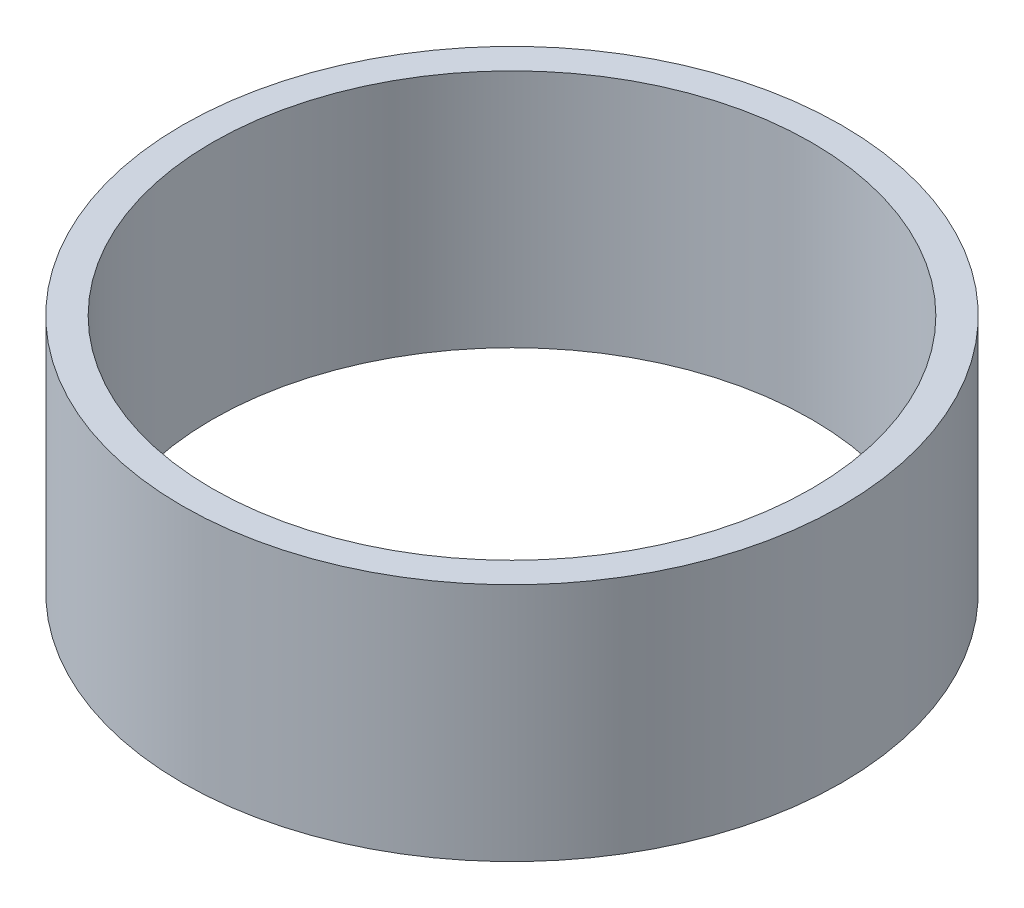
from build123d import *

# Parameters (mm, degrees)
SKETCH1_R           = 11
BOSS_EXTRUDE1_DEPTH = 8
SKETCH2_R           = 10
CUT_EXTRUDE1_DEPTH  = 18.492855685


with BuildPart() as part:
    # Sketch1 → Boss-Extrude1 (new body)
    with BuildSketch(Plane(origin=(0, 0, 0), x_dir=(1, 0, 0), z_dir=(0, 1, 0))):
        with Locations(Location((0, 0, 0), (0, 0, 270))):
            Circle(SKETCH1_R)
    extrude(amount=BOSS_EXTRUDE1_DEPTH)

    # Sketch2 → Cut-Extrude1 (cut, through all)
    with BuildSketch(Plane(origin=(0, 8, 0), x_dir=(1, 0, 0), z_dir=(0, 1, 0))):
        with Locations(Location((0, 0, 0), (0, 0, 270))):
            Circle(SKETCH2_R)
    extrude(amount=-CUT_EXTRUDE1_DEPTH, mode=Mode.SUBTRACT)


solid = part.part
